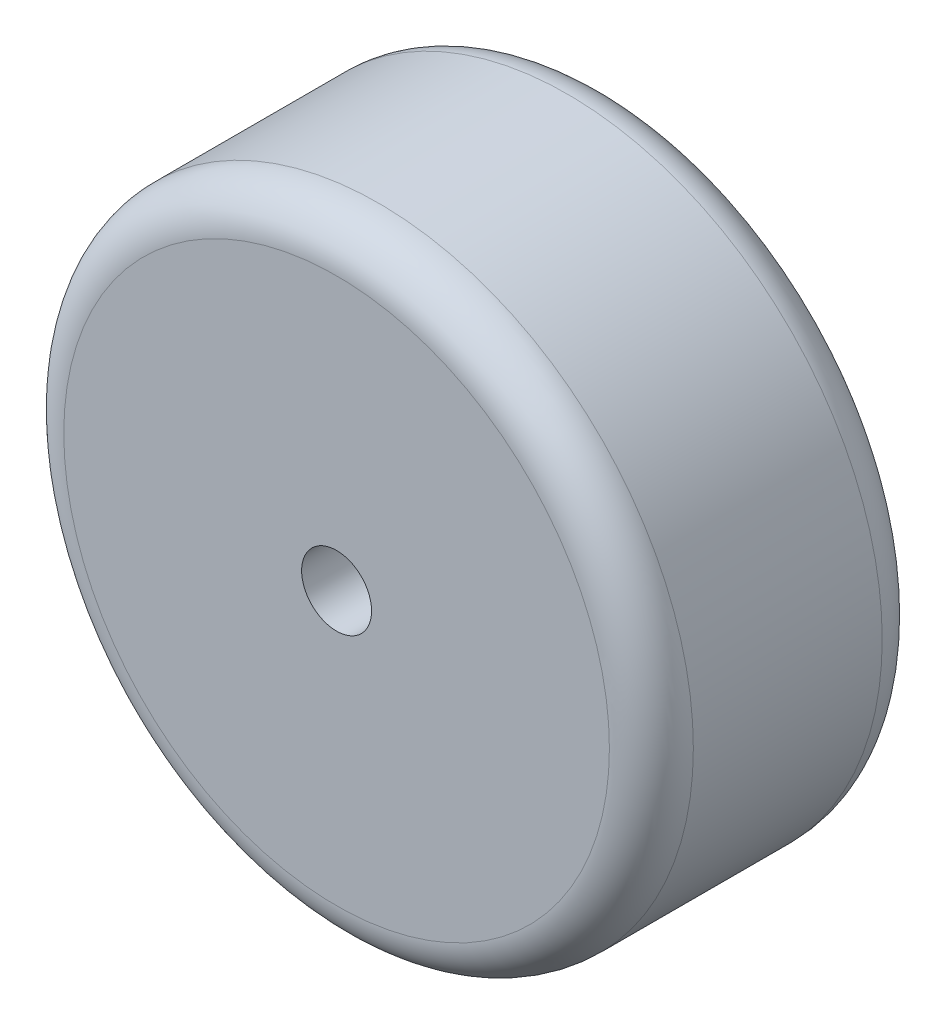
from build123d import *

# Parameters (mm, degrees)
SKETCH1_R           = 38.1
BOSS_EXTRUDE1_DEPTH = 33.02
FILLET1_R           = 5.08
SCALE1_SCALE        = 0.45
SKETCH3_R           = 1.905
CUT_EXTRUDE1_DEPTH  = 29.437509287


with BuildPart() as part:
    # Sketch1 → Boss-Extrude1 (new body)
    with BuildSketch(Plane.XY):
        Circle(SKETCH1_R)
    extrude(amount=BOSS_EXTRUDE1_DEPTH)

    # Fillet1
    fillet1_edges = [part.edges().sort_by_distance(p)[0] for p in [
        (-38.1, 0, 0),
        (-38.1, 0, 33.02),
    ]]
    fillet(fillet1_edges, radius=FILLET1_R)


with BuildPart() as part_1:
    # Scale1: scaled about (0, 0, 0)
    add(part.part.scale(SCALE1_SCALE))

    # Sketch3 → Cut-Extrude1 (cut, through all)
    with BuildSketch(Plane.XY.offset(14.859)):
        Circle(SKETCH3_R)
    extrude(amount=-CUT_EXTRUDE1_DEPTH, mode=Mode.SUBTRACT)


solid = part_1.part
